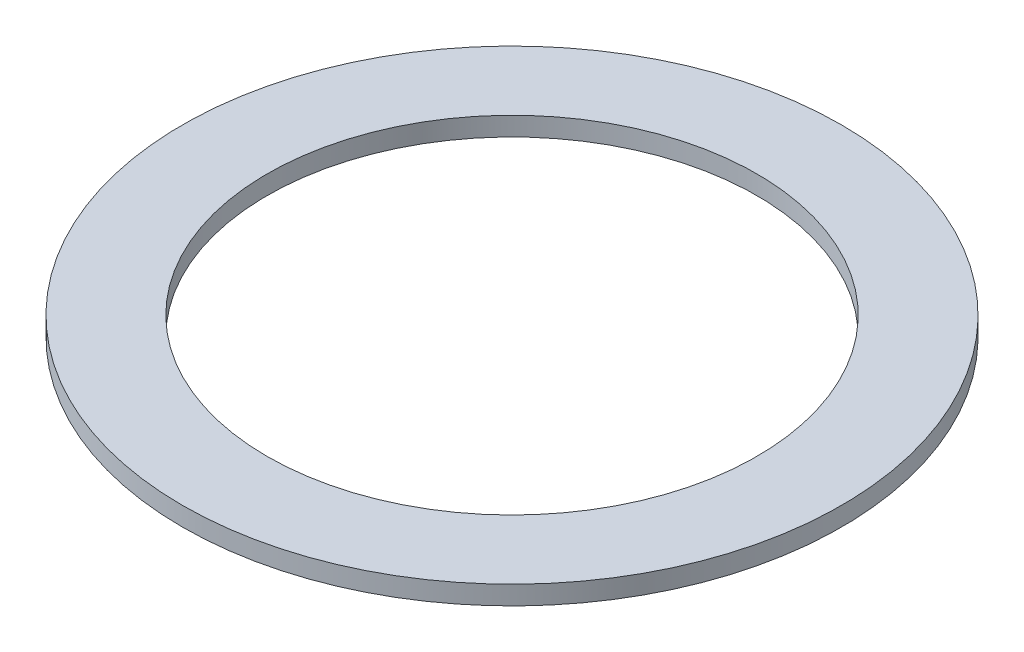
from build123d import *

# Parameters (mm, degrees)
SKETCH1_R           = 17.5
SKETCH1_R_2         = 13
BOSS_EXTRUDE1_DEPTH = 1


with BuildPart() as part:
    # Sketch1 → Boss-Extrude1 (new body)
    with BuildSketch(Plane(origin=(0, 0, 0), x_dir=(1, 0, 0), z_dir=(0, 1, 0))):
        with Locations(Location((0, 0, 0), (0, 0, 270))):
            Circle(SKETCH1_R)
        with Locations(Location((0, 0, 0), (0, 0, 270))):
            Circle(SKETCH1_R_2, mode=Mode.SUBTRACT)
    extrude(amount=BOSS_EXTRUDE1_DEPTH)


solid = part.part
